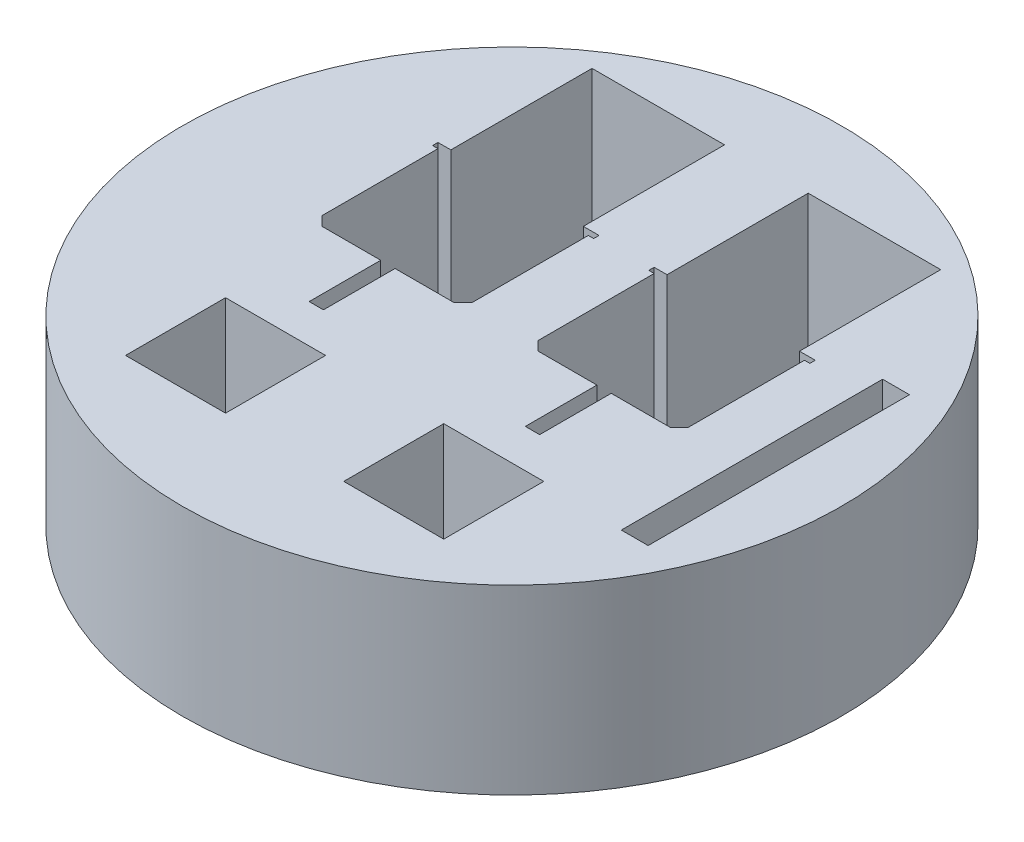
from build123d import *

# Parameters (mm, degrees)
SKETCH1_R           = 92.075
BOSS_EXTRUDE1_DEPTH = 50.8
SKETCH6_W           = 27.94
SKETCH6_H           = 27.94
CUT_EXTRUDE4_DEPTH  = 50.8
CUT_EXTRUDE5_DEPTH  = 50.8
SKETCH10_W          = 7.5
SKETCH10_H          = 73
CUT_EXTRUDE7_DEPTH  = 15.24


with BuildPart() as part:
    # Sketch1 → Boss-Extrude1 (new body)
    with BuildSketch(Plane(origin=(0, 0, 0), x_dir=(1, 0, 0), z_dir=(0, 1, 0))):
        with Locations(Location((0, 0, 0), (0, 0, 270))):
            Circle(SKETCH1_R)
    extrude(amount=BOSS_EXTRUDE1_DEPTH)

    # Sketch6 → Cut-Extrude4 (cut)
    with BuildSketch(Plane.XZ):
        with Locations((30.48, 49.53)):
            Rectangle(SKETCH6_W, SKETCH6_H)
        with Locations((-30.48, 49.53)):
            Rectangle(SKETCH6_W, SKETCH6_H)
    extrude(amount=-CUT_EXTRUDE4_DEPTH, mode=Mode.SUBTRACT)

    # Sketch8 → Cut-Extrude5 (cut)
    with BuildSketch(Plane(origin=(0, 50.8, 0), x_dir=(1, 0, 0), z_dir=(0, 1, 0))):
        Polygon((48.673227998, 66.920620093), (48.673227998, 31.675), (53.066023648, 31.675), (53.066023648, 30.175), (51.568299971, 30.175), (51.568299971, -2.285), (49.028299971, -4.825), (32.568299971, -4.825), (32.568299971, -24.825), (28.568299971, -24.825), (28.568299971, -4.825), (12.108299971, -4.825), (9.568299971, -2.285), (9.568299971, 30.175), (8.06602381, 30.175), (8.06602381, 31.675), (10.838299971, 31.675), (11.658892904, 31.675), (11.658892904, 66.920620093), (11.658892904, 71.12), (48.673227998, 71.12), align=None)
        Polygon((-8.831700029, -2.285), (-11.371700029, -4.825), (-27.831700029, -4.825), (-27.831700029, -24.825), (-31.831700029, -24.825), (-31.831700029, -4.825), (-48.291700029, -4.825), (-50.831700029, -2.285), (-50.831700029, 30.175), (-52.33397619, 30.175), (-52.33397619, 31.675), (-48.741107096, 31.675), (-48.741107096, 66.920620093), (-48.741107096, 71.12), (-11.726772002, 71.12), (-11.726772002, 66.920620093), (-11.726772002, 31.675), (-7.333976352, 31.675), (-7.333976352, 30.175), (-8.831700029, 30.175), align=None)
    extrude(amount=-CUT_EXTRUDE5_DEPTH, mode=Mode.SUBTRACT)

    # Sketch10 → Cut-Extrude7 (cut)
    with BuildSketch(Plane(origin=(0, 50.8, 0), x_dir=(1, 0, 0), z_dir=(0, 1, 0))):
        with Locations((70.806, 0)):
            Rectangle(SKETCH10_W, SKETCH10_H)
    extrude(amount=-CUT_EXTRUDE7_DEPTH, mode=Mode.SUBTRACT)


solid = part.part
